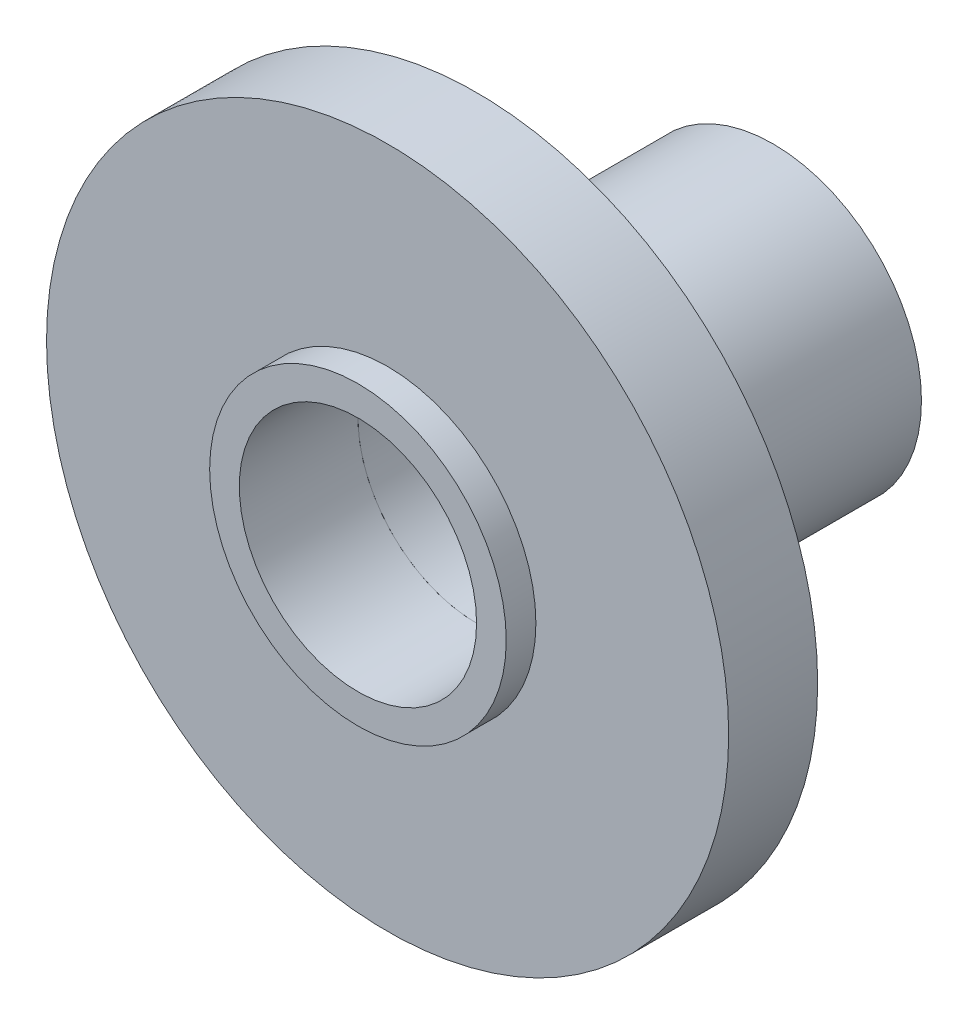
from build123d import *

# Parameters (mm, degrees)
SKETCH1_R           = 5
SKETCH1_R_2         = 4
BOSS_EXTRUDE1_DEPTH = 1
BOSS_EXTRUDE2_START = -3
SKETCH2_R           = 11.5
SKETCH2_R_2         = 4
BOSS_EXTRUDE2_DEPTH = 3
SKETCH5_R           = 5
SKETCH5_R_2         = 4
BOSS_EXTRUDE3_DEPTH = 10


with BuildPart() as part:
    # Sketch1 → Boss-Extrude1 (new body)
    with BuildSketch(Plane.XY):
        Circle(SKETCH1_R)
        Circle(SKETCH1_R_2, mode=Mode.SUBTRACT)
    extrude(amount=BOSS_EXTRUDE1_DEPTH)

    # Sketch2 → Boss-Extrude2 (add)
    with BuildSketch(Plane.XY.offset(BOSS_EXTRUDE2_START)):
        Circle(SKETCH2_R)
        Circle(SKETCH2_R_2, mode=Mode.SUBTRACT)
    extrude(amount=BOSS_EXTRUDE2_DEPTH)


with BuildPart() as body_2:
    # Sketch5 → Boss-Extrude3 (new body)
    with BuildSketch(Plane(origin=(0, 0, -3), x_dir=(-1, 0, 0), z_dir=(0, 0, -1))):
        Circle(SKETCH5_R)
        Circle(SKETCH5_R_2, mode=Mode.SUBTRACT)
    extrude(amount=BOSS_EXTRUDE3_DEPTH)


solid = Compound([part.part, body_2.part])
